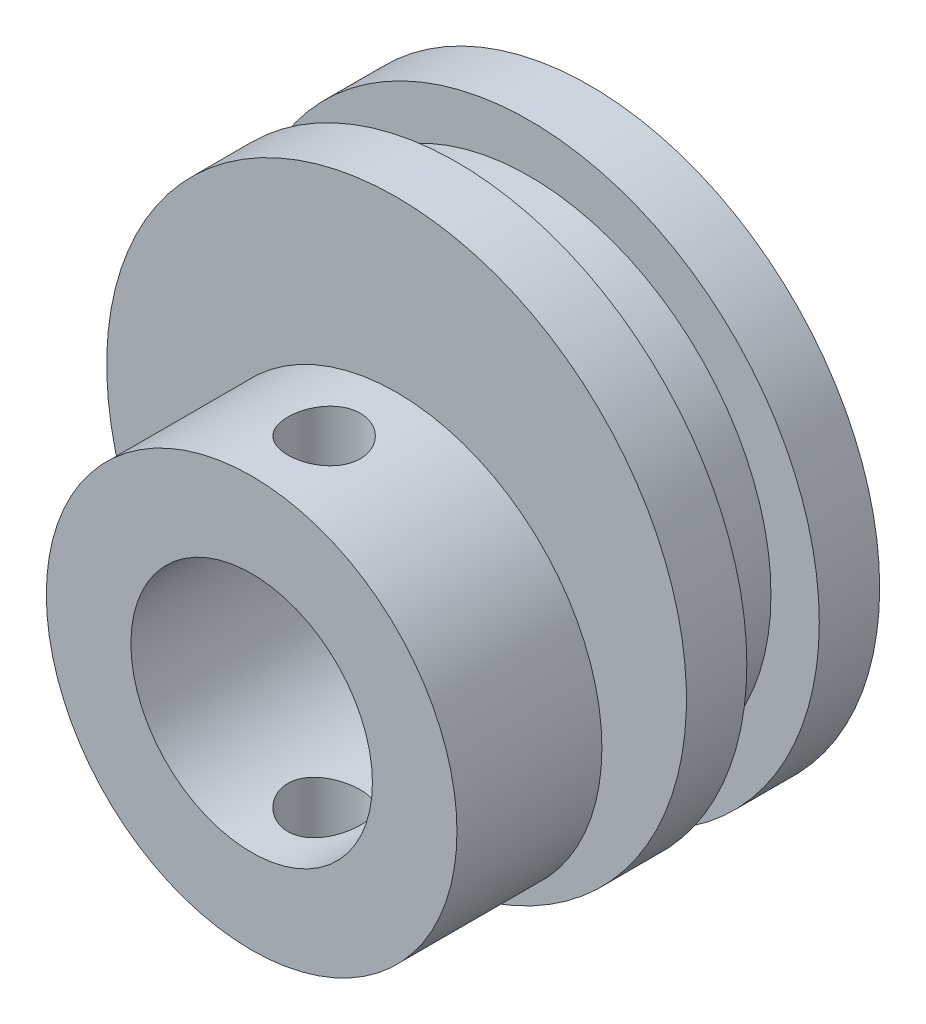
from build123d import *

# Parameters (mm, degrees)
SKETCH1_R               = 12
BOSS_EXTRUDE1_DEPTH     = 4
SKETCH3_W               = 3
SKETCH3_H               = 3.312885388
SKETCH6_R               = 8.5
BOSS_EXTRUDE2_DEPTH     = 6
CUT_EXTRUDE1_DEPTH      = 23
CUT_EXTRUDE1_DEPTH_BACK = 23
SKETCH7_R               = 5
CUT_EXTRUDE2_DEPTH      = 20.697715604
CUT_EXTRUDE2_DEPTH_BACK = 20.697715604
SKETCH8_R               = 1.5


with BuildPart() as part:
    # Sketch1 → Boss-Extrude1 (new, symmetric)
    with BuildSketch(Plane.XY):
        Circle(SKETCH1_R)
    extrude(amount=BOSS_EXTRUDE1_DEPTH, both=True)

    # Sketch3 → Cut-Revolve2 (revolve, cut)
    with BuildSketch(Plane(origin=(0, 0, 0), x_dir=(0, 0, -1), z_dir=(1, 0, 0)), mode=Mode.PRIVATE) as cut_revolve2_sk:
        with Locations((0, 11.656442694)):
            Rectangle(SKETCH3_W, SKETCH3_H)
    revolve(cut_revolve2_sk.sketch.rotate(Axis((0, 0, 0), (0, 0, 1)), 90), axis=Axis((0, 0, 0), (0, 0, 1)), mode=Mode.SUBTRACT)

    # Sketch6 → Boss-Extrude2 (add)
    with BuildSketch(Plane.XY.offset(4)):
        with Locations(Location((0, -3.5, 0), (0, 0, 270))):
            Circle(SKETCH6_R)
    extrude(amount=BOSS_EXTRUDE2_DEPTH)

    # Sketch7 → Cut-Extrude1 (cut, two sides: drawn at the far end of the back side and taken through both)
    with BuildSketch(Plane.XY.offset(10).offset(-CUT_EXTRUDE1_DEPTH_BACK)):
        with Locations((0, -3.5)):
            Circle(SKETCH7_R)
    extrude(amount=CUT_EXTRUDE1_DEPTH + CUT_EXTRUDE1_DEPTH_BACK, mode=Mode.SUBTRACT)

    # Sketch8 → Cut-Extrude2 (cut, two sides: drawn at the far end of the back side and taken through both)
    with BuildSketch(Plane(origin=(0, 0, 0), x_dir=(1, 0, 0), z_dir=(0, 1, 0)).offset(-CUT_EXTRUDE2_DEPTH_BACK)):
        with Locations(Location((0, -7, 0), (0, 0, 270))):
            Circle(SKETCH8_R)
    extrude(amount=CUT_EXTRUDE2_DEPTH + CUT_EXTRUDE2_DEPTH_BACK, mode=Mode.SUBTRACT)


solid = part.part
